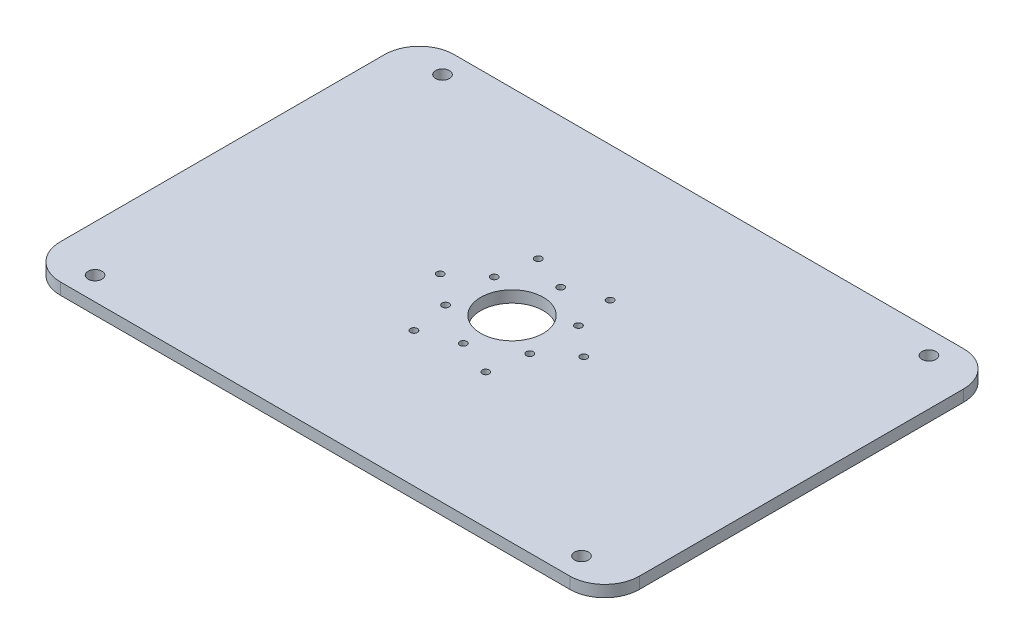
from build123d import *

# Parameters (mm, degrees)
SKETCH_1_W          = 250
SKETCH_1_H          = 170
SKETCH_1_R          = 3
EXTRUDE_1_DEPTH     = 5
FILLET_1_R          = 15
SKETCH_2_R          = 1.5
SKETCH_2_R_2        = 13.5
CUT_EXTRUDE_1_DEPTH = 152.244834623


with BuildPart() as part:
    # 草图1 → 凸台-拉伸1 (new body)
    with BuildSketch(Plane(origin=(0, 0, 0), x_dir=(1, 0, 0), z_dir=(0, 1, 0))):
        Rectangle(SKETCH_1_W, SKETCH_1_H)
        with Locations(Location((-105, 75, 0), (0, 0, 270))):
            Circle(SKETCH_1_R, mode=Mode.SUBTRACT)
        with Locations(Location((105, 75, 0), (0, 0, 270))):
            Circle(SKETCH_1_R, mode=Mode.SUBTRACT)
        with Locations(Location((-105, -75, 0), (0, 0, 270))):
            Circle(SKETCH_1_R, mode=Mode.SUBTRACT)
        with Locations(Location((105, -75, 0), (0, 0, 270))):
            Circle(SKETCH_1_R, mode=Mode.SUBTRACT)
    extrude(amount=EXTRUDE_1_DEPTH)

    # 圆角1
    fillet_1_edges = [part.edges().sort_by_distance(p)[0] for p in [
        (125, 2.5, 85),
        (-125, 2.5, 85),
        (-125, 2.5, -85),
        (125, 2.5, -85),
    ]]
    fillet(fillet_1_edges, radius=FILLET_1_R)

    # 草图2 → 切除-拉伸1 (cut, through all)
    with BuildSketch(Plane(origin=(0, 0, 0), x_dir=(1, 0, 0), z_dir=(0, 1, 0))):
        with Locations(Location((0, 21, 0), (0, 0, 270))):
            Circle(SKETCH_2_R)
        with Locations(Location((18.186533479, 10.5, 0), (0, 0, 270))):
            Circle(SKETCH_2_R)
        with Locations(Location((18.186533479, -10.5, 0), (0, 0, 270))):
            Circle(SKETCH_2_R)
        with Locations(Location((0, -21, 0), (0, 0, 270))):
            Circle(SKETCH_2_R)
        with Locations(Location((-18.186533479, -10.5, 0), (0, 0, 270))):
            Circle(SKETCH_2_R)
        with Locations(Location((-18.186533479, 10.5, 0), (0, 0, 270))):
            Circle(SKETCH_2_R)
        with Locations(Location((31, 0, 0), (0, 0, 270))):
            Circle(SKETCH_2_R)
        with Locations(Location((15.5, -26.846787517, 0), (0, 0, 270))):
            Circle(SKETCH_2_R)
        with Locations(Location((-15.5, -26.846787517, 0), (0, 0, 270))):
            Circle(SKETCH_2_R)
        with Locations(Location((-31, 0, 0), (0, 0, 270))):
            Circle(SKETCH_2_R)
        with Locations(Location((-15.5, 26.846787517, 0), (0, 0, 270))):
            Circle(SKETCH_2_R)
        with Locations(Location((15.5, 26.846787517, 0), (0, 0, 270))):
            Circle(SKETCH_2_R)
        with Locations(Location((0, 0, 0), (0, 0, 270))):
            Circle(SKETCH_2_R_2)
    extrude(amount=CUT_EXTRUDE_1_DEPTH, mode=Mode.SUBTRACT)


solid = part.part
